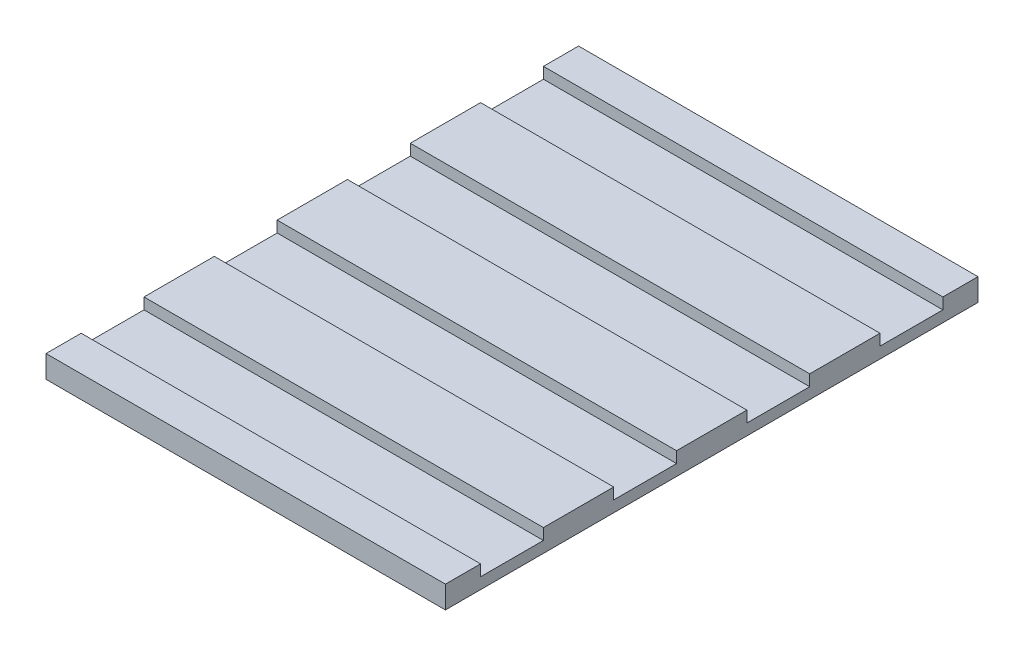
from build123d import *

# Parameters (mm, degrees)
SKETCH1_W           = 75
SKETCH1_H           = 100
BOSS_EXTRUDE2_DEPTH = 4.2
SKETCH4_W           = 75
SKETCH4_H           = 11.8
CUT_EXTRUDE2_DEPTH  = 2.1


with BuildPart() as part:
    # Sketch1 → Boss-Extrude2 (new body)
    with BuildSketch(Plane(origin=(0, 0, 0), x_dir=(1, 0, 0), z_dir=(0, 1, 0))):
        with Locations((26.666666667, 45.671296296)):
            Rectangle(SKETCH1_W, SKETCH1_H)
    extrude(amount=BOSS_EXTRUDE2_DEPTH)

    # Sketch4 → Cut-Extrude2 (cut)
    with BuildSketch(Plane(origin=(0, 4.2, 0), x_dir=(1, 0, 0), z_dir=(0, 1, 0))):
        with Locations((26.666666667, 83.171296296)):
            Rectangle(SKETCH4_W, SKETCH4_H)
        with Locations((26.666666667, 58.171296296)):
            Rectangle(SKETCH4_W, SKETCH4_H)
        with Locations((26.666666667, 33.171296296)):
            Rectangle(SKETCH4_W, SKETCH4_H)
        with Locations((26.666666667, 8.171296296)):
            Rectangle(SKETCH4_W, SKETCH4_H)
    extrude(amount=-CUT_EXTRUDE2_DEPTH, mode=Mode.SUBTRACT)


solid = part.part
